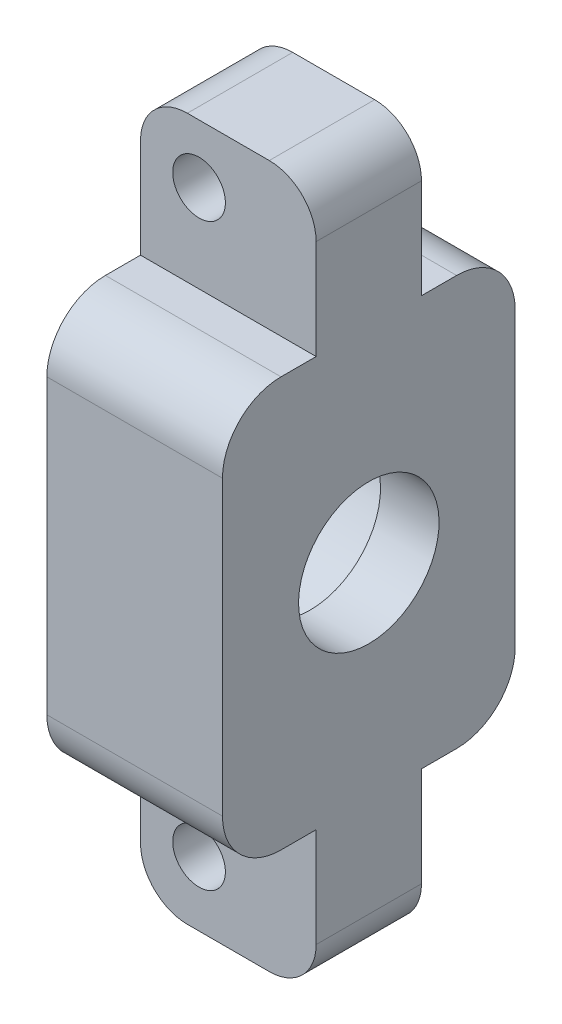
from build123d import *

# Parameters (mm, degrees)
SKETCH2_W           = 15
SKETCH2_H           = 60
BOSS_EXTRUDE1_DEPTH = 12.5
SKETCH3_W           = 8
SKETCH3_H           = 12.5
CUT_EXTRUDE1_DEPTH  = 36.794552658
SKETCH4_R           = 2.25
CUT_EXTRUDE2_DEPTH  = 36.288099977
FILLET1_R           = 5
FILLET2_R           = 4
SKETCH5_R           = 6
CUT_EXTRUDE3_DEPTH  = 36.794552658
SKETCH6_R           = 10
CUT_EXTRUDE4_DEPTH  = 10


with BuildPart() as part:
    # Sketch2 → Boss-Extrude1 (new, symmetric)
    with BuildSketch(Plane.XY):
        Rectangle(SKETCH2_W, SKETCH2_H)
    extrude(amount=BOSS_EXTRUDE1_DEPTH, both=True)

    # Sketch3 → Cut-Extrude1 (cut, through all)
    with BuildSketch(Plane(origin=(7.5, 0, 0), x_dir=(0, 0, -1), z_dir=(1, 0, 0))):
        with Locations((-8.5, -23.75)):
            Rectangle(SKETCH3_W, SKETCH3_H)
        with Locations((8.5, -23.75)):
            Rectangle(SKETCH3_W, SKETCH3_H)
        with Locations((8.5, 23.75)):
            Rectangle(SKETCH3_W, SKETCH3_H)
        with Locations((-8.5, 23.75)):
            Rectangle(SKETCH3_W, SKETCH3_H)
    extrude(amount=-CUT_EXTRUDE1_DEPTH, mode=Mode.SUBTRACT)

    # Sketch4 → Cut-Extrude2 (cut, through all)
    with BuildSketch(Plane.XY.offset(4.5)):
        with Locations((-2.5, 25)):
            Circle(SKETCH4_R)
        with Locations((-2.5, -24.5)):
            Circle(SKETCH4_R)
    extrude(amount=-CUT_EXTRUDE2_DEPTH, mode=Mode.SUBTRACT)

    # Fillet1
    fillet1_edges = [part.edges().sort_by_distance(p)[0] for p in [
        (0, 17.5, 12.5),
        (0, 17.5, -12.5),
        (0, -17.5, -12.5),
        (0, -17.5, 12.5),
    ]]
    fillet(fillet1_edges, radius=FILLET1_R)

    # Fillet2
    fillet2_edges = [part.edges().sort_by_distance(p)[0] for p in [
        (7.5, -30, 0),
        (-7.5, -30, 0),
        (-7.5, 30, 0),
        (7.5, 30, 0),
    ]]
    fillet(fillet2_edges, radius=FILLET2_R)

    # Sketch5 → Cut-Extrude3 (cut, through all)
    with BuildSketch(Plane.ZY.offset(7.5)):
        with Locations(Location((0, 0, 0), (0, 0, 270))):
            Circle(SKETCH5_R)
    extrude(amount=-CUT_EXTRUDE3_DEPTH, mode=Mode.SUBTRACT)

    # Sketch6 → Cut-Extrude4 (cut)
    with BuildSketch(Plane.ZY.offset(7.5)):
        with Locations(Location((0, 0, 0), (0, 0, 270))):
            Circle(SKETCH6_R)
    extrude(amount=-CUT_EXTRUDE4_DEPTH, mode=Mode.SUBTRACT)


solid = part.part
